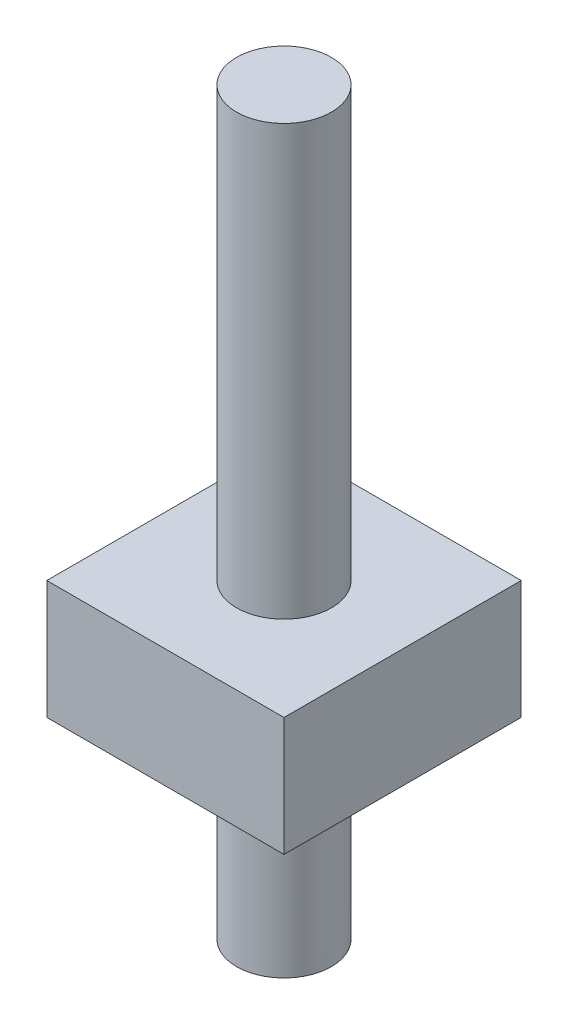
from build123d import *

# Parameters (mm, degrees)
BOSS_EXTRUDE1_DEPTH      = 15.6
BOSS_EXTRUDE1_DEPTH_BACK = 15.6
SKETCH1_R                = 2
BOSS_EXTRUDE2_DEPTH      = 5
BOSS_EXTRUDE2_DEPTH_BACK = 5
SKETCH3_W                = 10
SKETCH3_H                = 5


with BuildPart() as part:
    # Sketch1 → Boss-Extrude1 (new, two sides: drawn at the far end of the back side and taken through both)
    with BuildSketch(Plane(origin=(0, 0, 0), x_dir=(1, 0, 0), z_dir=(0, 1, 0)).offset(-BOSS_EXTRUDE1_DEPTH_BACK)):
        Circle(SKETCH1_R)
    extrude(amount=BOSS_EXTRUDE1_DEPTH + BOSS_EXTRUDE1_DEPTH_BACK)

    # Sketch3 → Boss-Extrude2 (add, two sides: drawn at the far end of the back side and taken through both)
    with BuildSketch(Plane(origin=(0, 0, 0), x_dir=(0, 0, -1), z_dir=(1, 0, 0)).offset(-BOSS_EXTRUDE2_DEPTH_BACK)):
        with Locations((0, -5)):
            Rectangle(SKETCH3_W, SKETCH3_H)
    extrude(amount=BOSS_EXTRUDE2_DEPTH + BOSS_EXTRUDE2_DEPTH_BACK)


solid = part.part
